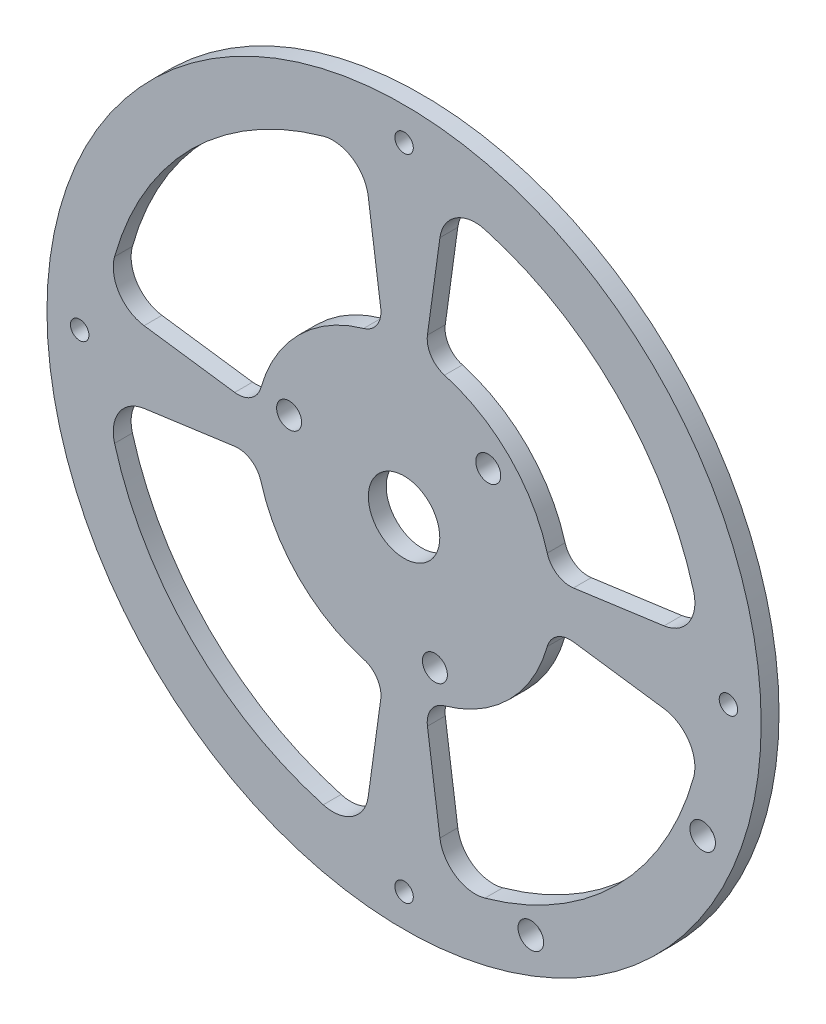
from build123d import *

# Parameters (mm, degrees)
SKETCH_1_R         = 60
SKETCH_1_R_2       = 1.55
SKETCH_1_R_3       = 2.1
SKETCH_1_R_4       = 6
EXTRUDE_1_DEPTH    = 3
SKETCH1_R          = 2.15
CUT_EXTRUDE1_DEPTH = 10


with BuildPart() as part:
    # 草图1 → 凸台-拉伸1 (new body)
    with BuildSketch(Plane.XY):
        Circle(SKETCH_1_R)
        with Locations((0, 54.5)):
            Circle(SKETCH_1_R_2, mode=Mode.SUBTRACT)
        with Locations((-54.5, 0)):
            Circle(SKETCH_1_R_2, mode=Mode.SUBTRACT)
        with Locations((0, -54.5)):
            Circle(SKETCH_1_R_2, mode=Mode.SUBTRACT)
        with Locations((54.5, 0)):
            Circle(SKETCH_1_R_2, mode=Mode.SUBTRACT)
        with Locations((14.142135624, 14.142135624)):
            Circle(SKETCH_1_R_3, mode=Mode.SUBTRACT)
        with Locations((5.176380902, -19.318516526)):
            Circle(SKETCH_1_R_3, mode=Mode.SUBTRACT)
        with Locations((-19.318516526, 5.176380902)):
            Circle(SKETCH_1_R_3, mode=Mode.SUBTRACT)
        Circle(SKETCH_1_R_4, mode=Mode.SUBTRACT)
        with BuildLine():
            Line((3.923217687, -28.453617749), (6.022703538, -43.680396542))
            ThreePointArc((6.022703538, -43.680396542), (8.67451724, -47.877141015), (13.579927123, -48.639855873))
            ThreePointArc((13.579927123, -48.639855873), (35.70889245, -35.70889245), (48.639855873, -13.579927123))
            ThreePointArc((48.639855873, -13.579927123), (47.877141015, -8.67451724), (43.680396542, -6.022703538))
            Line((43.680396542, -6.022703538), (28.453617749, -3.923217687))
            ThreePointArc((28.453617749, -3.923217687), (25.717860997, -4.538114468), (24.057984584, -6.7980422))
            ThreePointArc((24.057984584, -6.7980422), (17.67766953, -17.67766953), (6.7980422, -24.057984584))
            ThreePointArc((6.7980422, -24.057984584), (4.538114468, -25.717860997), (3.923217687, -28.453617749))
        make_face(mode=Mode.SUBTRACT)
        with BuildLine():
            Line((28.453617749, 3.923217687), (43.680396542, 6.022703538))
            ThreePointArc((43.680396542, 6.022703538), (47.877141015, 8.67451724), (48.639855873, 13.579927123))
            ThreePointArc((48.639855873, 13.579927123), (35.70889245, 35.70889245), (13.579927123, 48.639855873))
            ThreePointArc((13.579927123, 48.639855873), (8.67451724, 47.877141015), (6.022703538, 43.680396542))
            Line((6.022703538, 43.680396542), (3.923217687, 28.453617749))
            ThreePointArc((3.923217687, 28.453617749), (4.538114468, 25.717860997), (6.7980422, 24.057984584))
            ThreePointArc((6.7980422, 24.057984584), (17.67766953, 17.67766953), (24.057984584, 6.7980422))
            ThreePointArc((24.057984584, 6.7980422), (25.717860997, 4.538114468), (28.453617749, 3.923217687))
        make_face(mode=Mode.SUBTRACT)
        with BuildLine():
            Line((-28.453617749, -3.923217687), (-43.680396542, -6.022703538))
            ThreePointArc((-43.680396542, -6.022703538), (-47.877141015, -8.67451724), (-48.639855873, -13.579927123))
            ThreePointArc((-48.639855873, -13.579927123), (-35.70889245, -35.70889245), (-13.579927123, -48.639855873))
            ThreePointArc((-13.579927123, -48.639855873), (-8.67451724, -47.877141015), (-6.022703538, -43.680396542))
            Line((-6.022703538, -43.680396542), (-3.923217687, -28.453617749))
            ThreePointArc((-3.923217687, -28.453617749), (-4.538114468, -25.717860997), (-6.7980422, -24.057984584))
            ThreePointArc((-6.7980422, -24.057984584), (-17.67766953, -17.67766953), (-24.057984584, -6.7980422))
            ThreePointArc((-24.057984584, -6.7980422), (-25.717860997, -4.538114468), (-28.453617749, -3.923217687))
        make_face(mode=Mode.SUBTRACT)
        with BuildLine():
            Line((-3.923217687, 28.453617749), (-6.022703538, 43.680396542))
            ThreePointArc((-6.022703538, 43.680396542), (-8.67451724, 47.877141015), (-13.579927123, 48.639855873))
            ThreePointArc((-13.579927123, 48.639855873), (-35.70889245, 35.70889245), (-48.639855873, 13.579927123))
            ThreePointArc((-48.639855873, 13.579927123), (-47.877141015, 8.67451724), (-43.680396542, 6.022703538))
            Line((-43.680396542, 6.022703538), (-28.453617749, 3.923217687))
            ThreePointArc((-28.453617749, 3.923217687), (-25.717860997, 4.538114468), (-24.057984584, 6.7980422))
            ThreePointArc((-24.057984584, 6.7980422), (-17.67766953, 17.67766953), (-6.7980422, 24.057984584))
            ThreePointArc((-6.7980422, 24.057984584), (-4.538114468, 25.717860997), (-3.923217687, 28.453617749))
        make_face(mode=Mode.SUBTRACT)
    extrude(amount=EXTRUDE_1_DEPTH)

    # Sketch1 → Cut-Extrude1 (cut)
    with BuildSketch(Plane.XY.offset(3)):
        with Locations((50.167514513, -21.294846503)):
            Circle(SKETCH1_R)
        with Locations((21.294846503, -50.167514513)):
            Circle(SKETCH1_R)
    extrude(amount=-CUT_EXTRUDE1_DEPTH, mode=Mode.SUBTRACT)


solid = part.part
